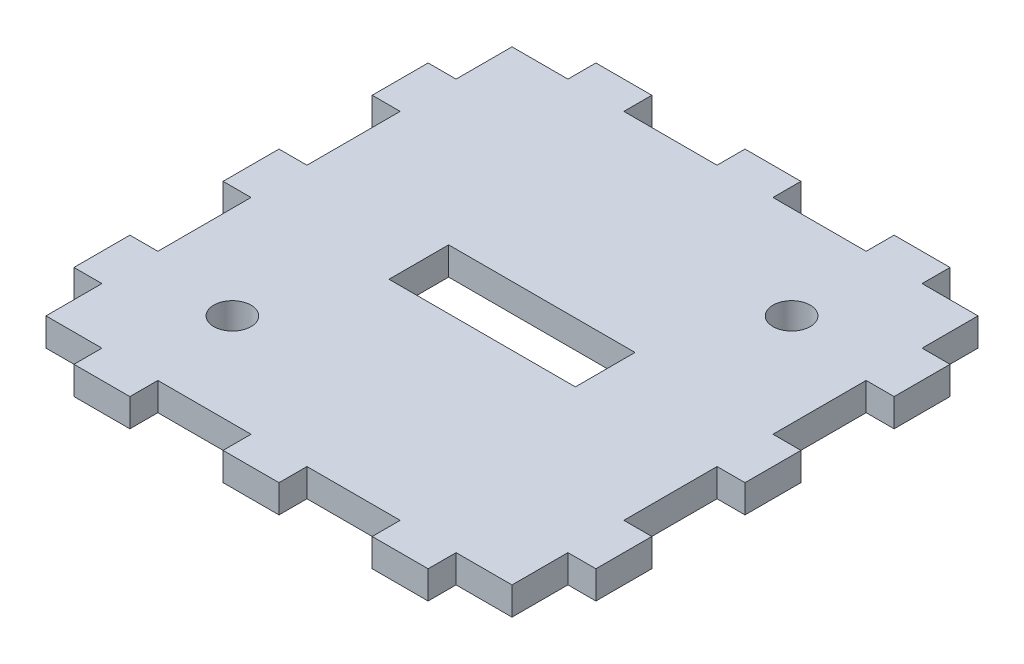
from build123d import *

# Parameters (mm, degrees)
SKETCH1_W           = 3
SKETCH1_H           = 6
SKETCH1_W_2         = 6
SKETCH1_H_2         = 3
SKETCH1_W_3         = 50
SKETCH1_H_3         = 50
BOSS_EXTRUDE1_DEPTH = 3
SKETCH2_R           = 2
SKETCH2_W           = 20
SKETCH2_H           = 6.4
CUT_EXTRUDE1_DEPTH  = 76.013332148


with BuildPart() as part:
    # Sketch1 → Boss-Extrude1 (new body)
    with BuildSketch(Plane(origin=(0, 0, 0), x_dir=(1, 0, 0), z_dir=(0, 1, 0))):
        with Locations((-51.5, 9)):
            Rectangle(SKETCH1_W, SKETCH1_H)
        with Locations((-51.5, 25)):
            Rectangle(SKETCH1_W, SKETCH1_H)
        with Locations((-51.5, 41)):
            Rectangle(SKETCH1_W, SKETCH1_H)
        with Locations((-41, 51.5)):
            Rectangle(SKETCH1_W_2, SKETCH1_H_2)
        with Locations((-25, 25)):
            Rectangle(SKETCH1_W_3, SKETCH1_H_3)
        with Locations((-25, 51.5)):
            Rectangle(SKETCH1_W_2, SKETCH1_H_2)
        with Locations((-9, 51.5)):
            Rectangle(SKETCH1_W_2, SKETCH1_H_2)
        with Locations((1.5, 41)):
            Rectangle(SKETCH1_W, SKETCH1_H)
        with Locations((1.5, 25)):
            Rectangle(SKETCH1_W, SKETCH1_H)
        with Locations((1.5, 9)):
            Rectangle(SKETCH1_W, SKETCH1_H)
        with Locations((-9, -1.5)):
            Rectangle(SKETCH1_W_2, SKETCH1_H_2)
        with Locations((-25, -1.5)):
            Rectangle(SKETCH1_W_2, SKETCH1_H_2)
        with Locations((-41, -1.5)):
            Rectangle(SKETCH1_W_2, SKETCH1_H_2)
    extrude(amount=BOSS_EXTRUDE1_DEPTH)

    # Sketch2 → Cut-Extrude1 (cut, through all)
    with BuildSketch(Plane(origin=(0, 3, 0), x_dir=(1, 0, 0), z_dir=(0, 1, 0))):
        with Locations(Location((-40, 10, 0), (0, 0, 270))):
            Circle(SKETCH2_R)
        with Locations(Location((-10, 40, 0), (0, 0, 270))):
            Circle(SKETCH2_R)
        with Locations((-25, 25)):
            Rectangle(SKETCH2_W, SKETCH2_H)
    extrude(amount=-CUT_EXTRUDE1_DEPTH, mode=Mode.SUBTRACT)


solid = part.part
